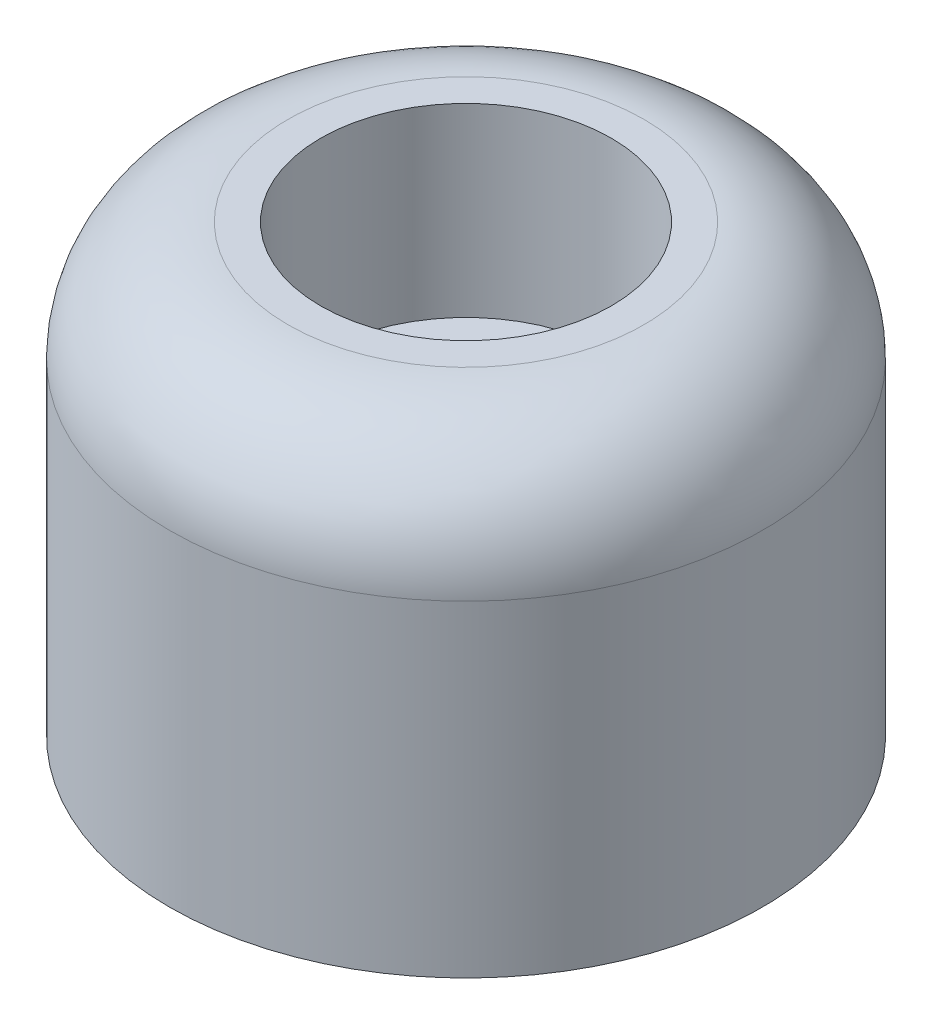
from build123d import *

# Parameters (mm, degrees)
CROQUIS1_R                                           = 12.7
SALIENTE_EXTRUIR1_DEPTH                              = 19.05
REFRENTADO_PARA_TORNILLO_CON_CABEZA_HUEC_D           = 8.2042
REFRENTADO_PARA_TORNILLO_CON_CABEZA_HUEC_DEPTH       = 19.7485
REFRENTADO_PARA_TORNILLO_CON_CABEZA_HUEC_CBORE_D     = 12.446
REFRENTADO_PARA_TORNILLO_CON_CABEZA_HUEC_CBORE_DEPTH = 7.9375
REFRENTADO_PARA_TORNILLO_CON_CABEZA_HUEC_TIP         = 2.464790345
REDONDEO1_R                                          = 5.08


with BuildPart() as part:
    # Croquis1 → Saliente-Extruir1 (new body)
    with BuildSketch(Plane(origin=(0, 0, 0), x_dir=(1, 0, 0), z_dir=(0, 1, 0))):
        with Locations(Location((0, 0, 0), (0, 0, 90))):
            Circle(CROQUIS1_R)
    extrude(amount=SALIENTE_EXTRUIR1_DEPTH)

    # Refrentado para tornillo con cabeza hueca de 5/161
    with Locations(Plane(origin=(0, 19.05, 0), x_dir=(1, 0, 0), z_dir=(0, 1, 0))):
        with Locations((0, 0)):
            CounterBoreHole(REFRENTADO_PARA_TORNILLO_CON_CABEZA_HUEC_D / 2, REFRENTADO_PARA_TORNILLO_CON_CABEZA_HUEC_CBORE_D / 2, REFRENTADO_PARA_TORNILLO_CON_CABEZA_HUEC_CBORE_DEPTH, depth=REFRENTADO_PARA_TORNILLO_CON_CABEZA_HUEC_DEPTH)
            with Locations((0, 0, -(REFRENTADO_PARA_TORNILLO_CON_CABEZA_HUEC_DEPTH + REFRENTADO_PARA_TORNILLO_CON_CABEZA_HUEC_TIP / 2))):  # 118° drill point
                Cone(0, REFRENTADO_PARA_TORNILLO_CON_CABEZA_HUEC_D / 2, REFRENTADO_PARA_TORNILLO_CON_CABEZA_HUEC_TIP, mode=Mode.SUBTRACT)

    # Redondeo1
    redondeo1_edges = [part.edges().sort_by_distance(p)[0] for p in [
        (0, 19.05, 12.7),
    ]]
    fillet(redondeo1_edges, radius=REDONDEO1_R)


solid = part.part
